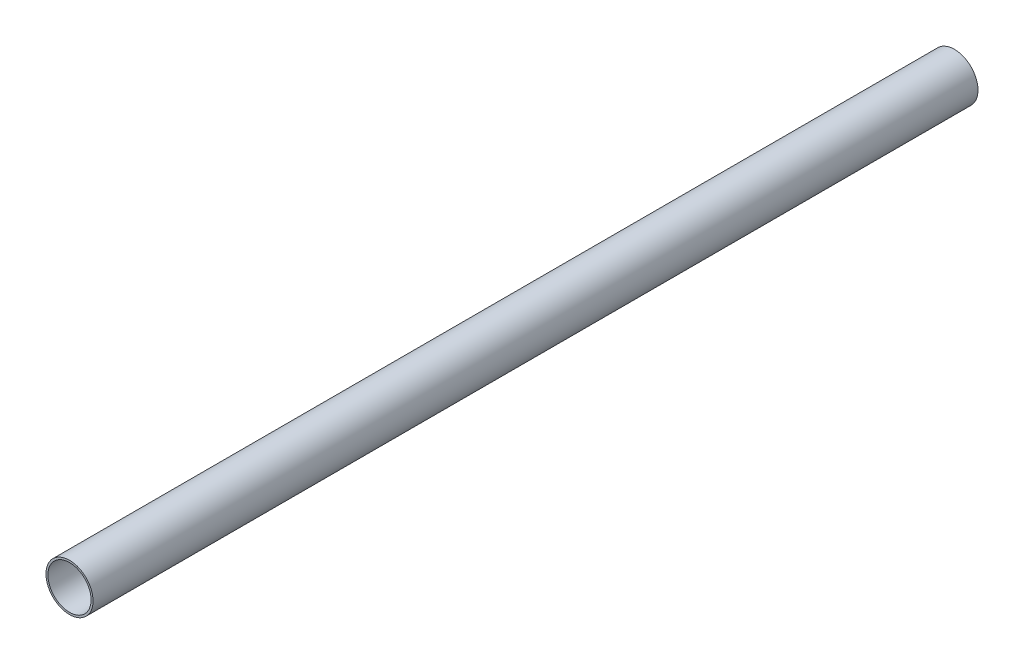
from build123d import *

# Parameters (mm, degrees)
IZIM1_R                     = 12
IZIM1_R_2                   = 11
Y_KSEKLIK_EKSTR_ZYON1_DEPTH = 451


with BuildPart() as part:
    # Çizim1 → Yükseklik-Ekstrüzyon1 (new body)
    with BuildSketch(Plane.XY):
        Circle(IZIM1_R)
        Circle(IZIM1_R_2, mode=Mode.SUBTRACT)
    extrude(amount=Y_KSEKLIK_EKSTR_ZYON1_DEPTH)


solid = part.part
